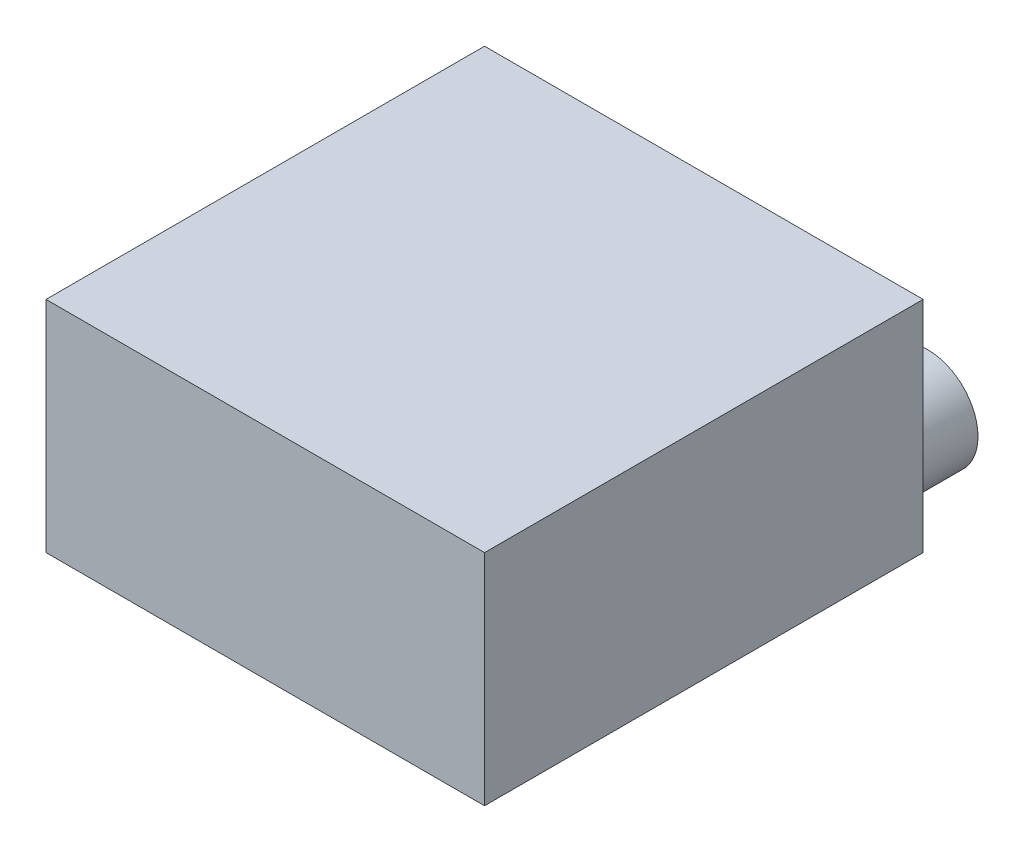
from build123d import *

# Parameters (mm, degrees)
SKETCH1_W           = 10
SKETCH1_H           = 10
BOSS_EXTRUDE1_DEPTH = 5
SKETCH2_R           = 1.143445087
BOSS_EXTRUDE2_DEPTH = 1.5


with BuildPart() as part:
    # Sketch1 → Boss-Extrude1 (new body)
    with BuildSketch(Plane(origin=(0, 0, 0), x_dir=(1, 0, 0), z_dir=(0, 1, 0))):
        with Locations((0.301507538, -4.346733668)):
            Rectangle(SKETCH1_W, SKETCH1_H)
    extrude(amount=BOSS_EXTRUDE1_DEPTH)

    # Sketch2 → Boss-Extrude2 (add)
    with BuildSketch(Plane(origin=(0, 0, -0.653266332), x_dir=(-1, 0, 0), z_dir=(0, 0, -1))):
        with Locations(Location((-3.909378049, 1.416407491, 0), (0, 0, 180))):
            Circle(SKETCH2_R)
    extrude(amount=BOSS_EXTRUDE2_DEPTH)


solid = part.part
